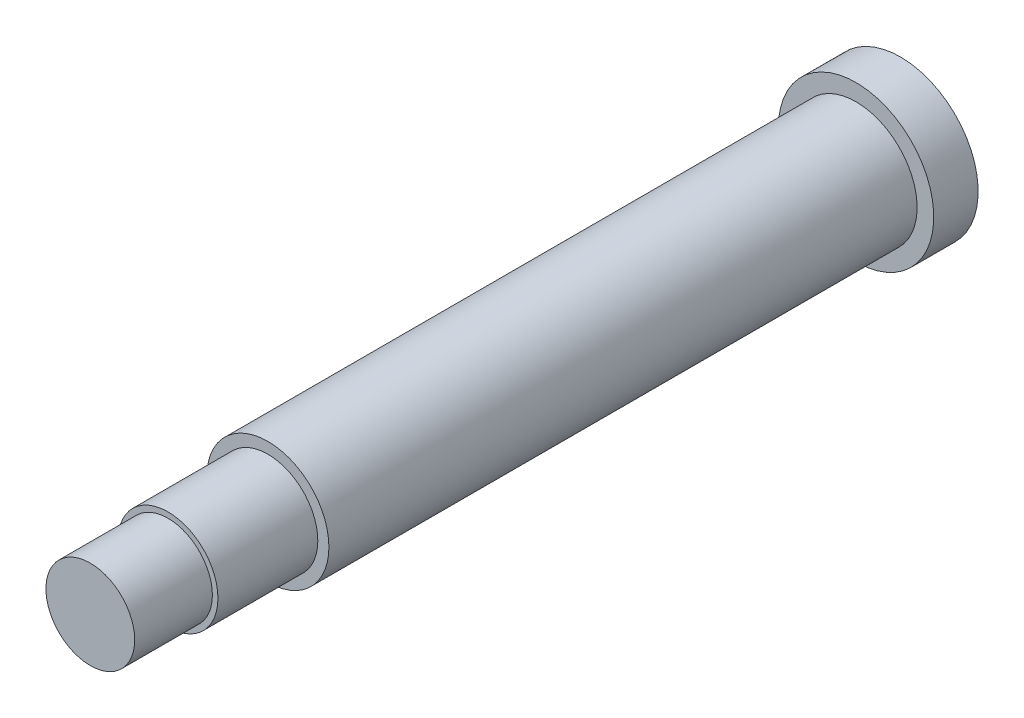
from build123d import *

# Parameters (mm, degrees)
SKETCH1_R      = 5.5
EXTRUDE1_DEPTH = 66
EXTRUDE2_START = -9
SKETCH3_R      = 5.5
SKETCH3_R_2    = 4.5
EXTRUDE2_DEPTH = 9
SKETCH4_R      = 7
EXTRUDE3_DEPTH = 4
SKETCH5_R      = 4
EXTRUDE4_DEPTH = 7


with BuildPart() as part:
    # Sketch1 → Extrude1 (new body)
    with BuildSketch(Plane.XY):
        Circle(SKETCH1_R)
    extrude(amount=EXTRUDE1_DEPTH)

    # Sketch3 → Extrude2 (cut)
    with BuildSketch(Plane.XY.offset(66).offset(EXTRUDE2_START)):
        Circle(SKETCH3_R)
        Circle(SKETCH3_R_2, mode=Mode.SUBTRACT)
    extrude(amount=EXTRUDE2_DEPTH, mode=Mode.SUBTRACT)

    # Sketch4 → Extrude3 (add)
    with BuildSketch(Plane(origin=(0, 0, 0), x_dir=(-1, 0, 0), z_dir=(0, 0, -1))):
        Circle(SKETCH4_R)
    extrude(amount=-EXTRUDE3_DEPTH)

    # Sketch5 → Extrude4 (add)
    with BuildSketch(Plane.XY.offset(66)):
        Circle(SKETCH5_R)
    extrude(amount=EXTRUDE4_DEPTH)


solid = part.part
